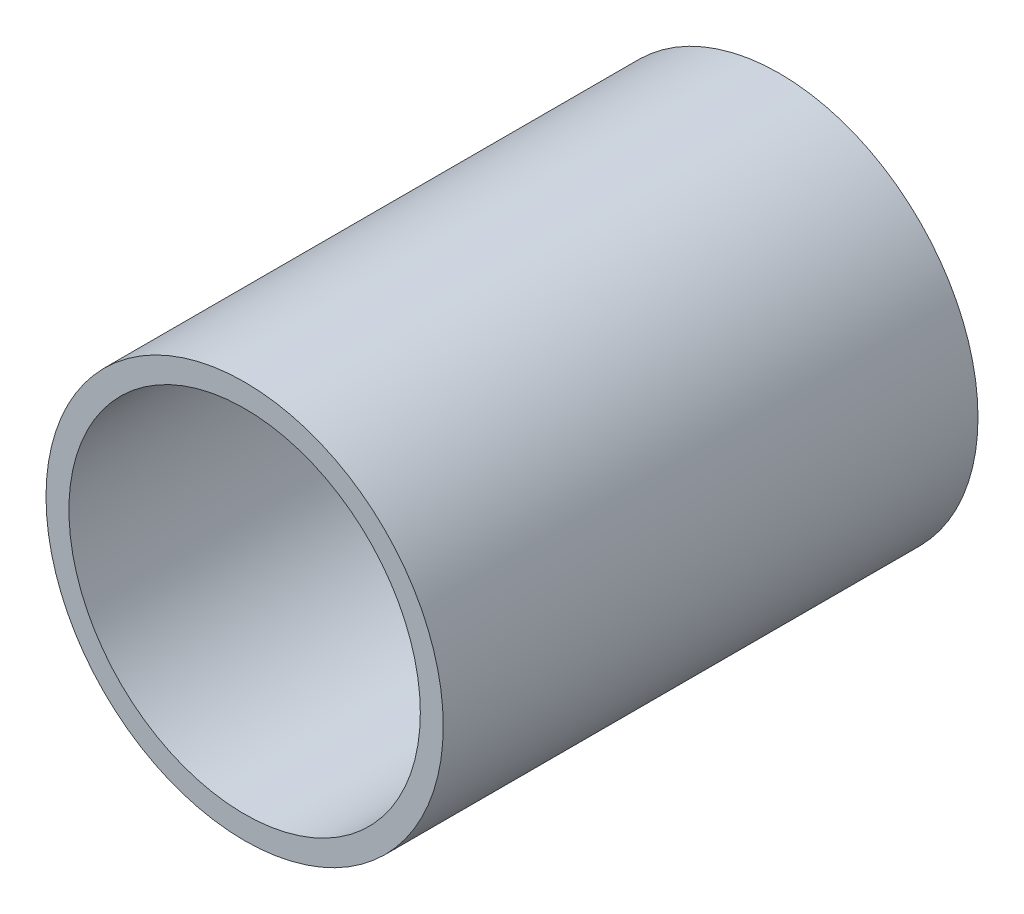
from build123d import *

# Parameters (mm, degrees)
SKETCH1_R           = 26
SKETCH1_R_2         = 23
BOSS_EXTRUDE1_DEPTH = 35


with BuildPart() as part:
    # Sketch1 → Boss-Extrude1 (new, symmetric)
    with BuildSketch(Plane(origin=(0, 0, 0), x_dir=(0, 1, 0), z_dir=(0, 0, 1))):
        with Locations(Location((0, 0, 0), (0, 0, 270))):
            Circle(SKETCH1_R)
        with Locations(Location((0, 0, 0), (0, 0, 270))):
            Circle(SKETCH1_R_2, mode=Mode.SUBTRACT)
    extrude(amount=BOSS_EXTRUDE1_DEPTH, both=True)


solid = part.part
